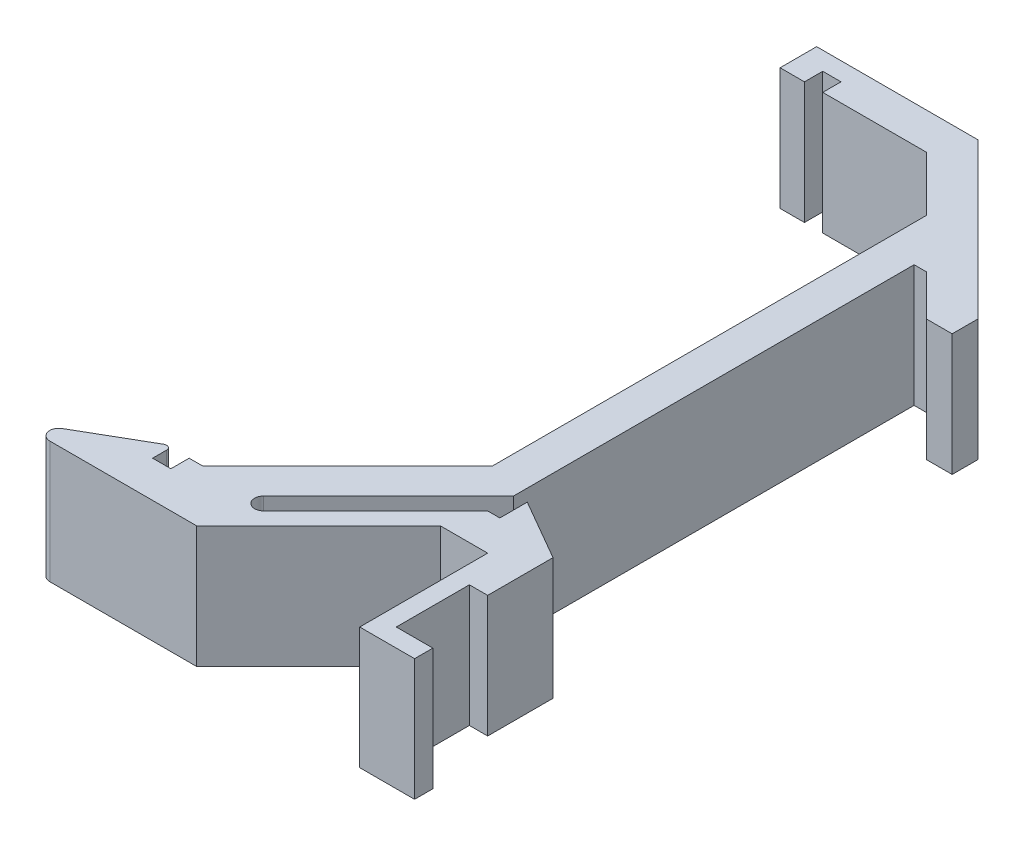
from build123d import *

# Parameters (mm, degrees)
EXTRUDE_2_DEPTH = 10


with BuildPart() as part:
    # Эскиз2 → Бобышка-Вытянуть2 (new body)
    with BuildSketch(Plane(origin=(0, 0, 0), x_dir=(1, 0, 0), z_dir=(0, 1, 0))):
        with BuildLine():
            Line((-12.853030774, -2.577511611), (-12.853030774, -4.077511611))
            Line((-12.853030774, -4.077511611), (-14.353030774, -4.077511611))
            Line((-14.353030774, -4.077511611), (-14.353030774, -2.927511611))
            ThreePointArc((-14.353030774, -2.927511611), (-14.528030774, -2.624402719), (-14.878030774, -2.624402719))
            Line((-14.878030774, -2.624402719), (-20.16700352, -5.677992558))
            ThreePointArc((-20.16700352, -5.677992558), (-20.516447889, -6.521625894), (-19.79200352, -7.077511611))
            Line((-19.79200352, -7.077511611), (-7.73171043, -7.077511611))
            Line((-7.73171043, -7.077511611), (2.26828957, 2.922488389))
            Line((2.26828957, 2.922488389), (6.146969226, 2.922488389))
            Line((6.146969226, 2.922488389), (6.146969226, -7.577511611))
            Line((6.146969226, -7.577511611), (10.646969226, -7.577511611))
            Line((10.646969226, -7.577511611), (10.646969226, -6.077511611))
            Line((10.646969226, -6.077511611), (7.646969226, -6.077511611))
            Line((7.646969226, -6.077511611), (7.646969226, -0.077511611))
            Line((7.646969226, -0.077511611), (9.146969226, -0.077511611))
            Line((9.146969226, -0.077511611), (9.146969226, 5.285737044))
            Line((9.146969226, 5.285737044), (4.146969226, 8.172488389))
            Line((4.146969226, 8.172488389), (4.146969226, 5.922488389))
            Line((4.146969226, 5.922488389), (3.146969226, 5.922488389))
            Line((3.146969226, 5.922488389), (-6.045418929, -3.269899766))
            ThreePointArc((-6.045418929, -3.269899766), (-6.568677947, -3.486640748), (-7.091936965, -3.269899766))
            Line((-7.091936965, -3.269899766), (-7.106079101, -3.25575763))
            ThreePointArc((-7.106079101, -3.25575763), (-7.322820083, -2.732498612), (-7.106079101, -2.209239594))
            Line((-7.106079101, -2.209239594), (3.146969226, 8.043808733))
            Line((3.146969226, 8.043808733), (3.146969226, 40.922488389))
            Line((3.146969226, 40.922488389), (4.146969226, 40.922488389))
            Line((4.146969226, 40.922488389), (7.496211631, 37.573245985))
            Line((7.496211631, 37.573245985), (9.617531975, 37.573245985))
            Line((9.617531975, 37.573245985), (9.617531975, 39.694566328))
            Line((9.617531975, 39.694566328), (-3.110390087, 52.422488389))
            Line((-3.110390087, 52.422488389), (-16.353030774, 52.422488389))
            Line((-16.353030774, 52.422488389), (-16.353030774, 49.422488389))
            Line((-16.353030774, 49.422488389), (-14.353030774, 49.422488389))
            Line((-14.353030774, 49.422488389), (-14.353030774, 50.922488389))
            Line((-14.353030774, 50.922488389), (-12.853030774, 50.922488389))
            Line((-12.853030774, 50.922488389), (-12.853030774, 49.422488389))
            Line((-12.853030774, 49.422488389), (-4.353030774, 49.422488389))
            Line((-4.353030774, 49.422488389), (0.146969226, 44.922488389))
            Line((0.146969226, 44.922488389), (0.146969226, 9.28644942))
            Line((0.146969226, 9.28644942), (-11.716991804, -2.577511611))
            Line((-11.716991804, -2.577511611), (-12.853030774, -2.577511611))
        make_face()
    extrude(amount=EXTRUDE_2_DEPTH)


solid = part.part
